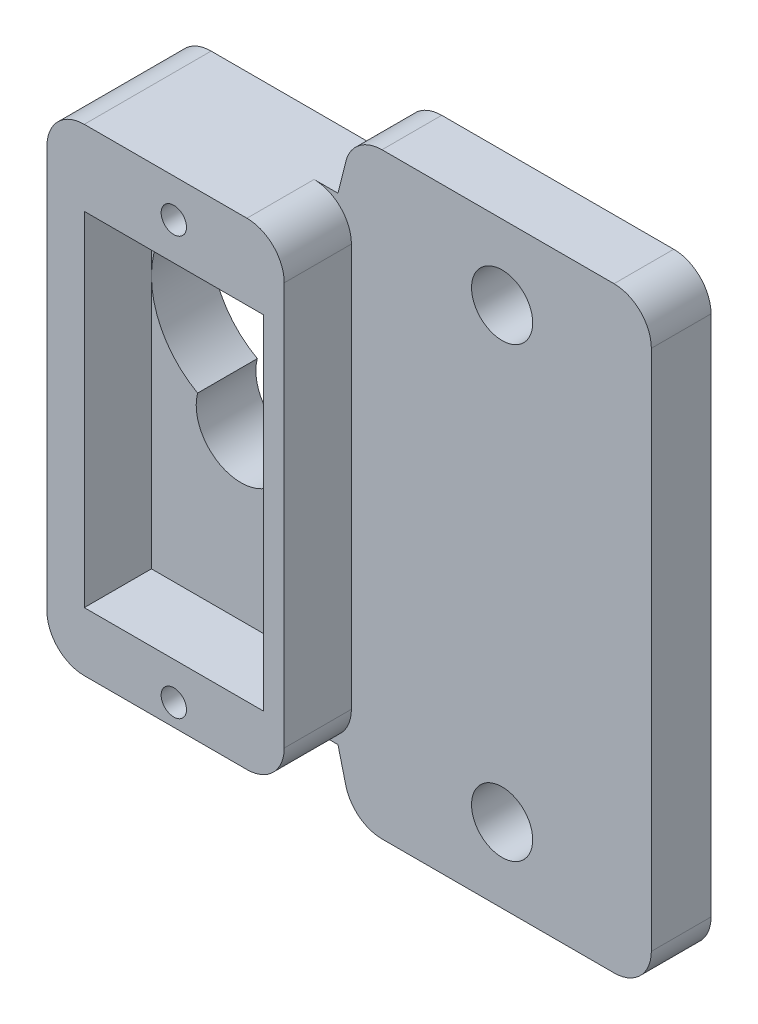
from build123d import *

# Parameters (mm, degrees)
ESQUISSE1_R             = 2.05
BOSS_EXTRU_1_DEPTH      = 4
BOSS_EXTRU_2_DEPTH      = 4.5
ESQUISSE3_R             = 0.85
ENL_V_MAT_EXTRU_1_DEPTH = 8
CONG_1_R                = 2.5


with BuildPart() as part:
    # Esquisse1 → Boss.-Extru.1 (new body)
    with BuildSketch(Plane.XY):
        Polygon((0, 20), (20, 20), (20, -20), (0, -20), (-1, -16), (-16, -16), (-16, 16), (-1, 16), align=None)
        with Locations((10, 15)):
            Circle(ESQUISSE1_R, mode=Mode.SUBTRACT)
        with Locations((10, -15)):
            Circle(ESQUISSE1_R, mode=Mode.SUBTRACT)
        with BuildLine():
            ThreePointArc((-10.40473751, -0.3), (-7.5, 10.95), (-4.59526249, -0.3))
            ThreePointArc((-4.59526249, -0.3), (-7.5, -4.05), (-10.40473751, -0.3))
        make_face(mode=Mode.SUBTRACT)
    extrude(amount=BOSS_EXTRU_1_DEPTH)

    # Esquisse2 → Boss.-Extru.2 (add)
    with BuildSketch(Plane.XY.offset(4)):
        with BuildLine():
            Line((-0.1, -13.5), (-0.1, 13.5))
            ThreePointArc((-0.1, 13.5), (-0.832233047, 15.267766953), (-2.6, 16))
            Line((-2.6, 16), (-16, 16))
            Line((-16, 16), (-16, -16))
            Line((-16, -16), (-2.6, -16))
            ThreePointArc((-2.6, -16), (-0.832233047, -15.267766953), (-0.1, -13.5))
        make_face()
        Polygon((-1.5, 4.950000005), (-1.5, -12.05), (-13.5, -12.05), (-13.5, 4.95), (-13.5, 10.95), (-7.499999947, 10.95), (-1.5, 10.95), align=None, mode=Mode.SUBTRACT)
    extrude(amount=BOSS_EXTRU_2_DEPTH)

    # Esquisse3 → Enlèv. mat.-Extru.1 (cut)
    with BuildSketch(Plane.XY.offset(8.5)):
        with Locations((-7.5, 13.45)):
            Circle(ESQUISSE3_R)
        with Locations((-7.5, -14.55)):
            Circle(ESQUISSE3_R)
    extrude(amount=-ENL_V_MAT_EXTRU_1_DEPTH, mode=Mode.SUBTRACT)

    # Congé1
    cong_1_edges = [part.edges().sort_by_distance(p)[0] for p in [
        (-16, -16, 4.25),
        (-16, 16, 4.25),
        (0, 20, 2),
        (20, 20, 2),
        (20, -20, 2),
        (0, -20, 2),
    ]]
    fillet(cong_1_edges, radius=CONG_1_R)


solid = part.part
